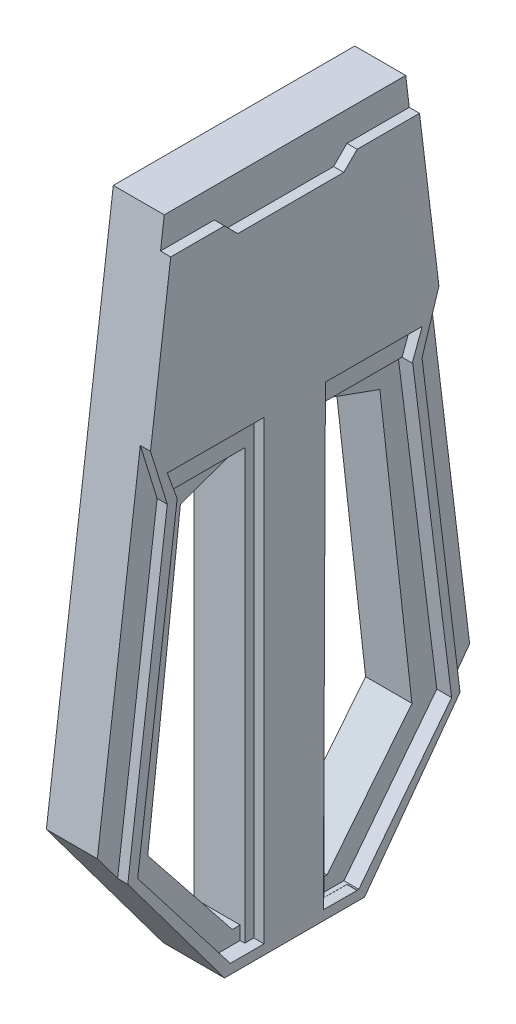
from build123d import *

# Parameters (mm, degrees)
BOSS_EXTRUDE1_DEPTH = 13.2
CUT_EXTRUDE1_DEPTH  = 2.2
CUT_EXTRUDE5_DEPTH  = 3.2
CUT_EXTRUDE7_DEPTH  = 47.2


with BuildPart() as part:
    # Sketch1 → Boss-Extrude1 (new body)
    with BuildSketch(Plane(origin=(0, 0, 0), x_dir=(0, 0, -1), z_dir=(1, 0, 0))):
        Polygon((0, 0), (30.22758915, 0), (55.09957656, 33.798540965), (41.306638332, 146.917141225), (-10.793062749, 146.917141225), (-25.237530543, 33.798540965), align=None)
    extrude(amount=BOSS_EXTRUDE1_DEPTH)

    # Sketch2 → Cut-Extrude1 (cut)
    with BuildSketch(Plane(origin=(13.2, 0, 0), x_dir=(0, 0, -1), z_dir=(1, 0, 0))):
        Polygon((28.624161599, 2.054828055), (21.342036292, 2.087122062), (21.778356485, 100.474982686), (42.652153848, 100.428698447), (40.492448974, 94.591340826), (48.720604882, 27.79821975), align=None)
        Polygon((55.09957656, 33.798540965), (46.273401218, 106.183741554), (42.626224982, 94.581878179), (50.828950912, 27.995188239), align=None)
        Polygon((-12.344468939, 94.703766721), (-15.966114176, 106.40555265), (-25.237530543, 33.798540965), (-20.868748173, 27.947791436), align=None)
        Polygon((8.529328424, 100.504360243), (8.529328424, 2.115532151), (1.247131511, 2.115532151), (-18.734951184, 27.947791436), (-10.21067195, 94.703766721), (-12.344468939, 100.550644482), align=None)
        Polygon((-10.793062749, 146.917141225), (-11.605073068, 140.558065069), (0, 140.558065069), (2.885234275, 137.672830794), (15.236290042, 137.672830794), (15.256787792, 146.917141225), align=None)
        Polygon((41.306638332, 146.917141225), (15.256787792, 146.917141225), (15.236290042, 137.672830794), (25.738927324, 137.672830794), (28.624161599, 140.558065069), (42.08202226, 140.558065069), align=None)
    extrude(amount=-CUT_EXTRUDE1_DEPTH, mode=Mode.SUBTRACT)

    # Sketch5 → Cut-Extrude5 (cut)
    with BuildSketch(Plane(origin=(13.2, 0, 0), x_dir=(0, 0, -1), z_dir=(1, 0, 0))):
        Polygon((6.582413404, 94.703766721), (-10.21067195, 94.703766721), (-18.734951184, 27.947791436), (1.247131511, 2.115532151), (6.582413404, 2.115532151), align=None)
        Polygon((49.016878853, 27.881849151), (40.622561704, 94.654291163), (23.829508165, 94.686980269), (23.649277638, 2.098921115), (28.984549423, 2.088535555), align=None)
    extrude(amount=-CUT_EXTRUDE5_DEPTH, mode=Mode.SUBTRACT)

    # Sketch8 → Cut-Extrude7 (cut)
    with BuildSketch(Plane(origin=(10, 0, 0), x_dir=(0, 0, -1), z_dir=(1, 0, 0))):
        Polygon((6.582413404, 94.703766721), (-6.314173101, 90.065077615), (-13.364980543, 27.947791436), (4.888229968, 5.020235463), (6.582413404, 5.020235463), align=None)
        Polygon((25.349112106, 5.000321059), (23.654931879, 5.003618925), (23.829508165, 94.686980269), (36.717040651, 90.023195697), (43.646918386, 27.892302235), align=None)
    extrude(amount=-CUT_EXTRUDE7_DEPTH, mode=Mode.SUBTRACT)


solid = part.part
